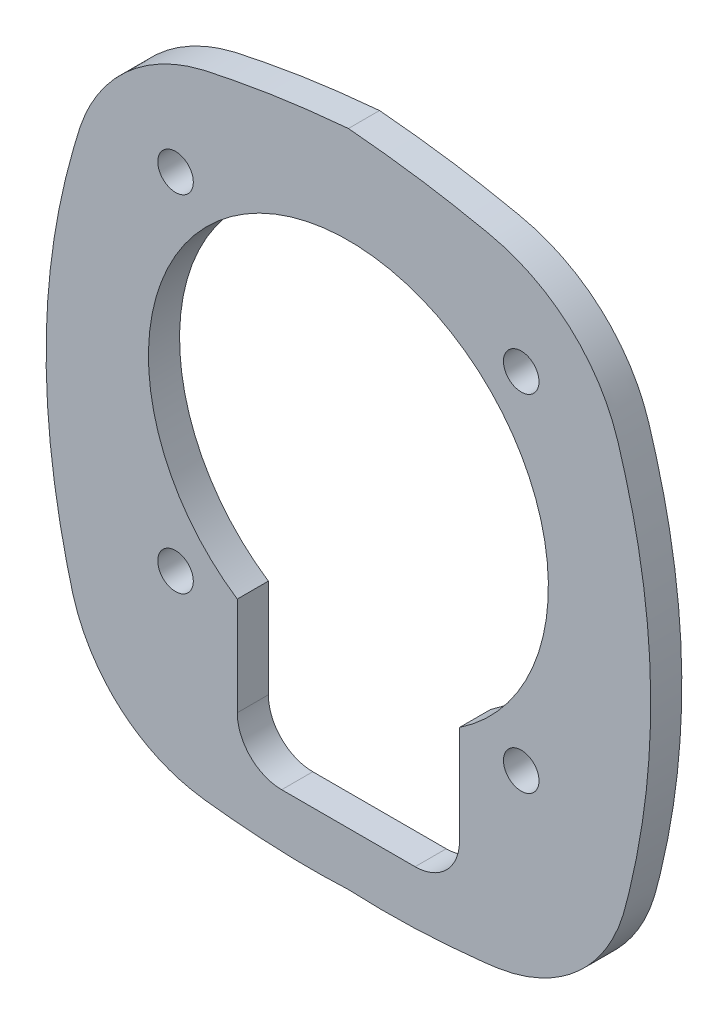
from build123d import *

# Parameters (mm, degrees)
SKETCH_1_R      = 1.6
EXTRUDE_1_DEPTH = 1.4


with BuildPart() as part:
    # Эскиз1 → Бобышка-Вытянуть1 (new, symmetric)
    with BuildSketch(Plane.XY):
        with BuildLine():
            add(Edge.make_bspline(
                [(0.000543, 130.358525827), (-1.945480452, 130.188499042), (-4.858381253, 129.868758565), (-8.722413487, 129.258161877), (-11.12234795, 128.792595305), (-13.035868432, 128.409370125), (-15.023219751, 127.849253361), (-17.351772976, 126.80088508), (-19.874012416, 125.013083487), (-21.983692934, 122.745525763), (-23.315799928, 120.550392172), (-24.097065652, 118.633733215), (-24.664484094, 116.740013738), (-25.324645571, 114.384544217), (-26.199834657, 110.55245516), (-26.960203324, 105.69535151), (-27.303219026, 99.799698554), (-27.111126776, 94.885322218), (-26.692325113, 90.981037438), (-26.247283233, 88.069183809), (-25.778255009, 85.666957643), (-25.339018869, 83.748313297), (-24.995965962, 82.339063868), (-24.576009703, 80.859594873), (-23.792214984, 78.961000016), (-22.44744941, 76.75433051), (-20.274622822, 74.517298165), (-17.659232969, 72.83435817), (-15.232095848, 71.946730968), (-13.201847179, 71.569027983), (-11.248420049, 71.365492175), (-8.819033004, 71.134967909), (-5.882129687, 70.975232523), (-2.940560559, 70.924896089), (-0.980653767, 70.986457369), (-0.001478501, 71.030590936)],
                knots=[-0.000757093, -0.000757093, -0.000757093, -0.000757093, 0.061765011, 0.093026062, 0.124287114, 0.13991764, 0.155548166, 0.186809218, 0.21807027, 0.249331322, 0.280592374, 0.2962229, 0.311853426, 0.343114478, 0.37437553, 0.436897634, 0.499419738, 0.561941842, 0.593202894, 0.624463946, 0.655724998, 0.671355524, 0.68698605, 0.702616576, 0.718247101, 0.749508153, 0.780769205, 0.812030257, 0.843291309, 0.858921835, 0.874552361, 0.905813413, 0.937074465, 0.968335517, 0.999596569, 0.999596569, 0.999596569, 0.999596569], degree=3))
            add(Edge.make_bspline(
                [(-0.001478501, 71.030590936), (1.95712441, 70.935080551), (4.90472948, 70.91995137), (8.816661818, 71.135466338), (11.254603959, 71.364975586), (13.196074826, 71.5696698), (15.234935039, 71.946208927), (17.657345201, 72.834060289), (20.274534247, 74.517209174), (22.447305021, 76.753754196), (23.791458396, 78.95999613), (24.575713155, 80.857910204), (24.994914701, 82.336019543), (25.339299688, 83.748205686), (25.777448237, 85.664500027), (26.247270381, 88.068171008), (26.691912963, 90.979494194), (27.11115847, 94.883692427), (27.303051995, 99.798771254), (26.960668379, 105.69131923), (26.200366981, 110.548978069), (25.325712758, 114.381140724), (24.665217429, 116.736075727), (24.098249664, 118.630835966), (23.317850059, 120.54626777), (21.982767519, 122.747268843), (19.873279136, 125.013547239), (17.351613221, 126.801120988), (15.022072031, 127.849466554), (13.037310829, 128.409258097), (11.12135831, 128.792757062), (8.72255397, 129.258080327), (4.858084444, 129.869349057), (1.945954411, 130.185901402), (0.000543, 130.358525827)],
                knots=[0.000403383, 0.000403383, 0.000403383, 0.000403383, 0.062925491, 0.094186544, 0.125447598, 0.141078125, 0.156708652, 0.187969705, 0.219230759, 0.250491812, 0.281752866, 0.297383393, 0.31301392, 0.328644447, 0.344274973, 0.375536027, 0.406797081, 0.438058134, 0.500580242, 0.563102349, 0.625624456, 0.65688551, 0.688146563, 0.70377709, 0.719407617, 0.750668671, 0.781929724, 0.813190778, 0.844451832, 0.860082358, 0.875712885, 0.906973939, 0.938234992, 1.0007571, 1.0007571, 1.0007571, 1.0007571], degree=3))
        make_face()
        with Locations((15.556349186, 88.080595835)):
            Circle(SKETCH_1_R, mode=Mode.SUBTRACT)
        with Locations((15.556349186, 119.193294207)):
            Circle(SKETCH_1_R, mode=Mode.SUBTRACT)
        with Locations((-15.559306188, 119.193294207)):
            Circle(SKETCH_1_R, mode=Mode.SUBTRACT)
        with Locations((-15.559306188, 88.080595835)):
            Circle(SKETCH_1_R, mode=Mode.SUBTRACT)
        with BuildLine():
            Line((-6.004910411, 75.812044251), (6.001953409, 75.812044251))
            ThreePointArc((6.001953409, 75.812044251), (8.830380533, 76.983617126), (10.001953409, 79.812044251))
            Line((10.001953409, 79.812044251), (10.001953409, 88.671620834))
            ThreePointArc((10.001953409, 88.671620834), (0.00177843, 121.636944933), (-10.004910411, 88.673597545))
            Line((-10.004910411, 88.673597545), (-10.004910411, 79.812044251))
            ThreePointArc((-10.004910411, 79.812044251), (-8.833337536, 76.983617126), (-6.004910411, 75.812044251))
        make_face(mode=Mode.SUBTRACT)
    extrude(amount=EXTRUDE_1_DEPTH, both=True)


solid = part.part
